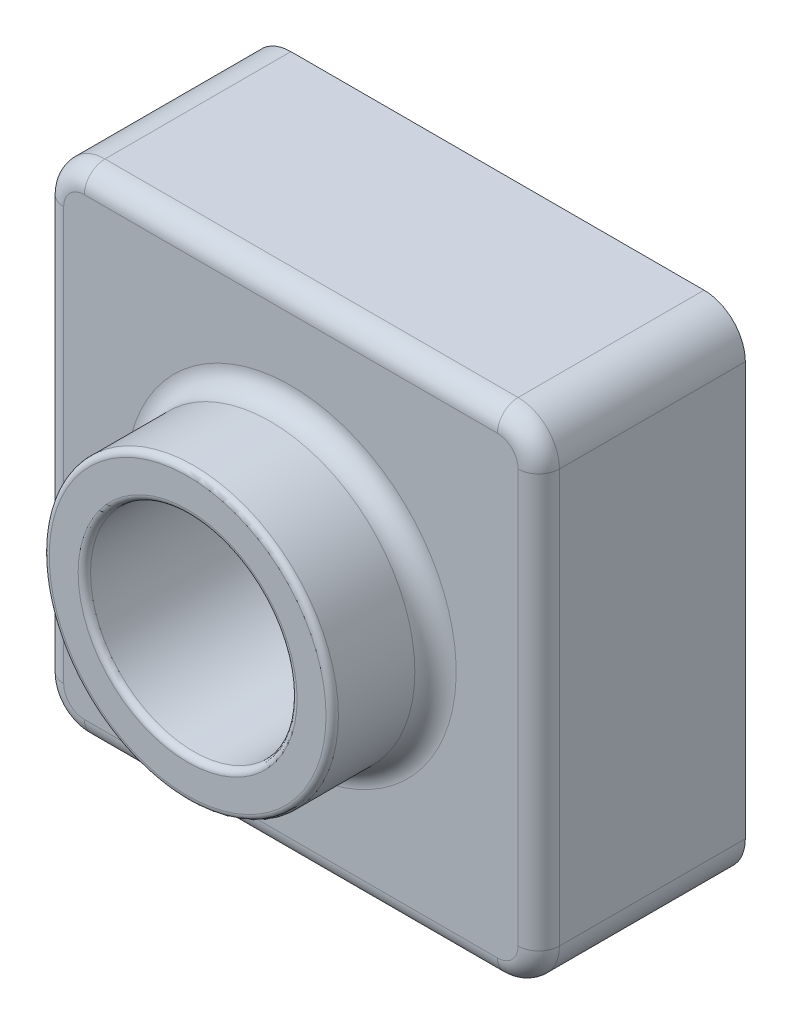
from build123d import *

# Parameters (mm, degrees)
SKETCH1_W           = 120
SKETCH1_H           = 120
BOSS_EXTRUDE1_DEPTH = 50
SKETCH2_R           = 35
BOSS_EXTRUDE2_DEPTH = 25
SKETCH3_R           = 25
CUT_EXTRUDE1_DEPTH  = 186.539753153
FILLET1_R           = 10
FILLET2_R           = 1.5
FILLET3_R           = 5
SHELL1_T            = -2


with BuildPart() as part:
    # Sketch1 → Boss-Extrude1 (new body)
    with BuildSketch(Plane.XY):
        with Locations((60, 60)):
            Rectangle(SKETCH1_W, SKETCH1_H)
    extrude(amount=BOSS_EXTRUDE1_DEPTH)

    # Sketch2 → Boss-Extrude2 (add)
    with BuildSketch(Plane.XY.offset(50)):
        with Locations((60, 60)):
            Circle(SKETCH2_R)
    extrude(amount=BOSS_EXTRUDE2_DEPTH)

    # Sketch3 → Cut-Extrude1 (cut, through all)
    with BuildSketch(Plane.XY.offset(75)):
        with Locations((60, 60)):
            Circle(SKETCH3_R)
    extrude(amount=-CUT_EXTRUDE1_DEPTH, mode=Mode.SUBTRACT)

    # Fillet1
    fillet1_edges = [part.edges().sort_by_distance(p)[0] for p in [
        (0, 120, 25),
        (120, 120, 25),
        (120, 0, 25),
        (0, 0, 25),
    ]]
    fillet(fillet1_edges, radius=FILLET1_R)

    # Fillet2
    fillet2_edges = [part.edges().sort_by_distance(p)[0] for p in [
        (25, 60, 75),
        (35, 60, 75),
    ]]
    fillet(fillet2_edges, radius=FILLET2_R)

    # Fillet3
    fillet3_edges = [part.edges().sort_by_distance(p)[0] for p in [
        (25, 60, 50),
        (60, 0, 50),
        (0, 60, 50),
        (120, 60, 50),
        (60, 120, 50),
        (117.071067812, 117.071067812, 50),
        (117.071067812, 2.928932188, 50),
        (2.928932188, 117.071067812, 50),
        (2.928932188, 2.928932188, 50),
    ]]
    fillet(fillet3_edges, radius=FILLET3_R)

    # Shell1
    shell1_openings = [part.faces().sort_by_distance(p)[0] for p in [
        (60, 1.697056275, 0),
    ]]
    offset(amount=SHELL1_T, openings=shell1_openings, kind=Kind.INTERSECTION)


solid = part.part
